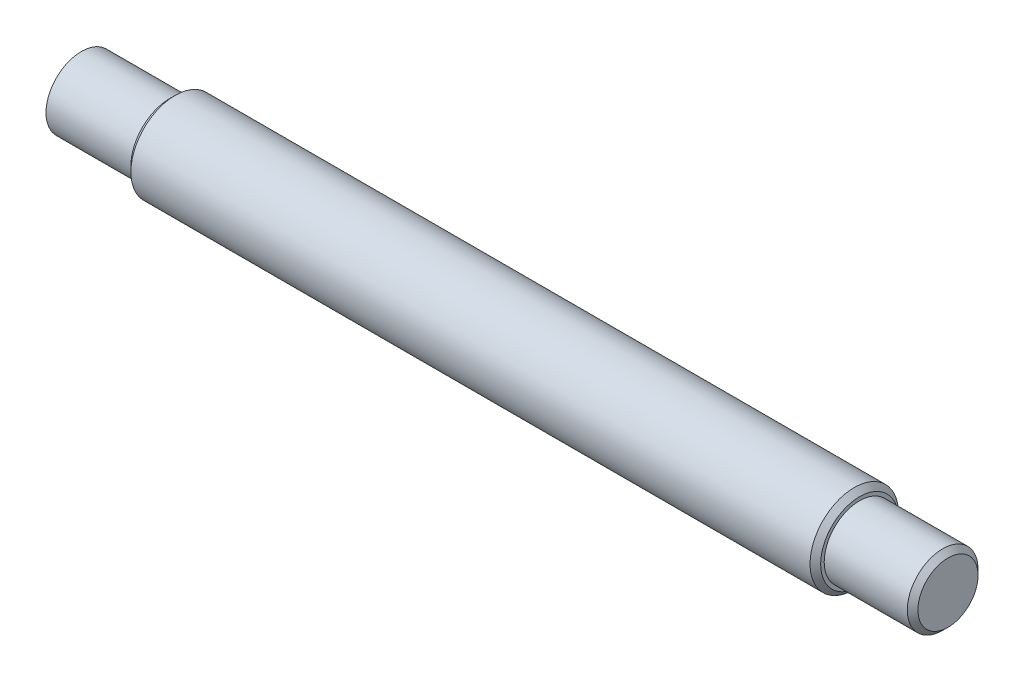
from build123d import *

# Parameters (mm, degrees)
CHANFREIN1_SIZE = 0.3


with BuildPart() as part:
    # Esquisse1 → Révolution1 (revolve)
    with BuildSketch(Plane.XY, mode=Mode.PRIVATE) as r_volution1_sk:
        Polygon((36, 0), (36, 2), (31, 2), (31, 2.5), (-8, 2.5), (-8, 2), (-13, 2), (-13, 1.2), (0, 1.2), (0, 0), align=None)
    revolve(r_volution1_sk.sketch.rotate(Axis((-77.893994415, 0, 0), (1, 0, 0)), 90), axis=Axis((-77.893994415, 0, 0), (1, 0, 0)))

    # Chanfrein1
    chanfrein1_edges = [part.edges().sort_by_distance(p)[0] for p in [
        (36, 0, -2),
        (-8, 0, -2.5),
        (31, 0, -2.5),
    ]]
    chamfer(chanfrein1_edges, length=CHANFREIN1_SIZE)


solid = part.part
